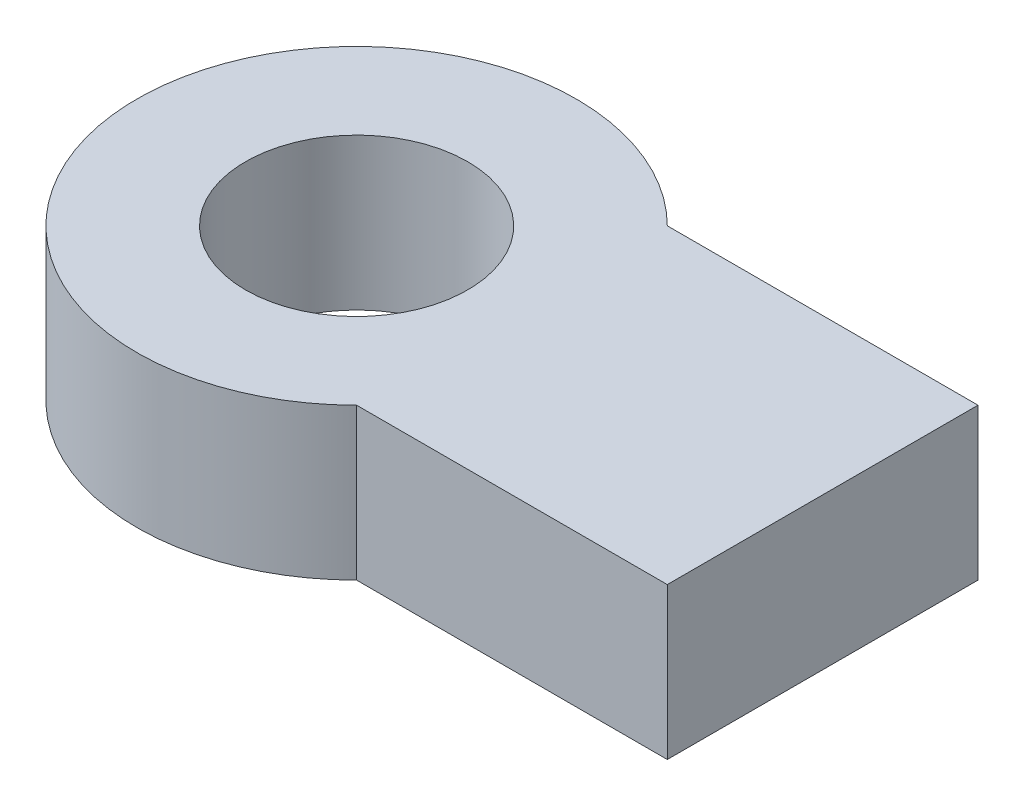
from build123d import *

# Parameters (mm, degrees)
SKETCH_2_R      = 1.1
EXTRUDE_1_DEPTH = 1.5


with BuildPart() as part:
    # 草图2 → 凸台-拉伸1 (new body)
    with BuildSketch(Plane(origin=(0, 0, 0), x_dir=(1, 0, 0), z_dir=(0, 1, 0))):
        with BuildLine():
            Line((1.537957249, 1.537957249), (4.613871747, 1.537957249))
            Line((4.613871747, 1.537957249), (4.613871747, -1.537957249))
            Line((4.613871747, -1.537957249), (1.537957249, -1.537957249))
            ThreePointArc((1.537957249, -1.537957249), (-2.175, 0), (1.537957249, 1.537957249))
        make_face()
        with Locations(Location((0, 0, 0), (0, 0, 270))):
            Circle(SKETCH_2_R, mode=Mode.SUBTRACT)
    extrude(amount=EXTRUDE_1_DEPTH)


solid = part.part
